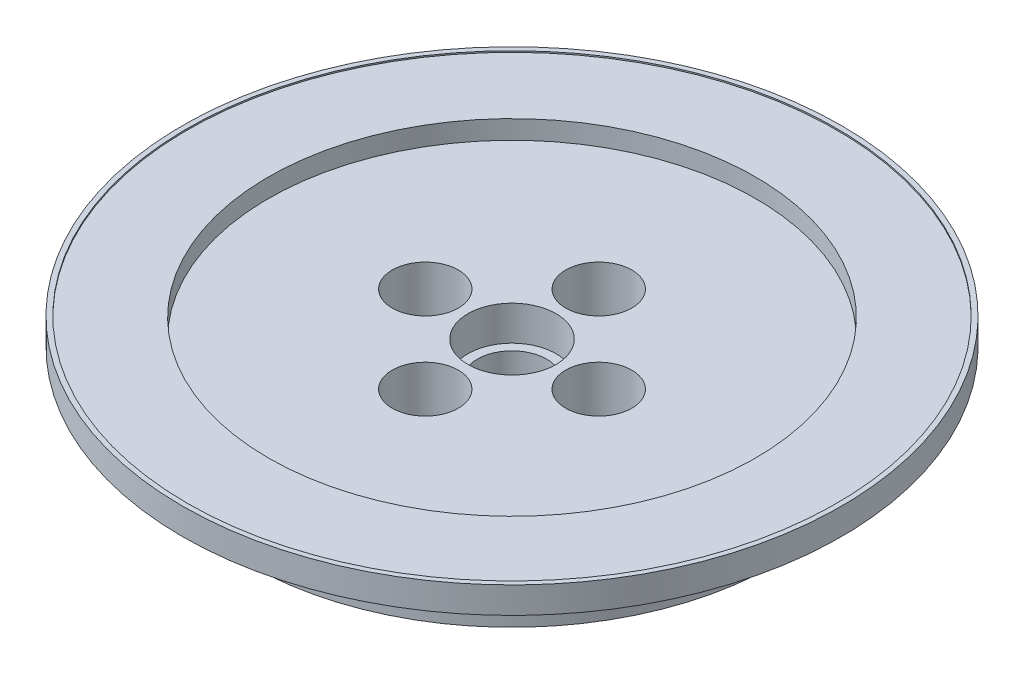
from build123d import *

# Parameters (mm, degrees)
M8_CLEARANCE_HOLE1_D     = 9.525
M8_CLEARANCE_HOLE1_DEPTH = 11.938


with BuildPart() as part:
    # Sketch1 → Revolve1 (revolve)
    with BuildSketch(Plane(origin=(0, 0, 0), x_dir=(-1, 0, 0), z_dir=(0, 0, -1)), mode=Mode.PRIVATE) as revolve1_sk:
        Polygon((-38.1, -11.938), (0, -11.938), (0, 0), (-47.498, 0), (-47.498, -3.81), (-38.1, -7.230592262), align=None)
    revolve(revolve1_sk.sketch.rotate(Axis((0, -11.938, 0), (0, 1, 0)), 270), axis=Axis((0, -11.938, 0), (0, 1, 0)))

    # Sketch2 → Cut-Revolve1 (revolve, cut)
    with BuildSketch(Plane(origin=(0, 0, 0), x_dir=(-1, 0, 0), z_dir=(0, 0, -1)), mode=Mode.PRIVATE) as cut_revolve1_sk:
        Polygon((-5, -11.938), (0, -11.938), (0, 0), (-46.798, 0), (-46.798, -0.2), (-35.1, -0.2), (-35.1, -2.9), (-6.35, -2.9), (-6.35, -7.898), (-5, -7.898), align=None)
    revolve(cut_revolve1_sk.sketch.rotate(Axis((0, -11.938, 0), (0, 1, 0)), 270), axis=Axis((0, -11.938, 0), (0, 1, 0)), mode=Mode.SUBTRACT)

    # M8 Clearance Hole1
    with Locations(Plane(origin=(0, -11.938, 0), x_dir=(-1, 0, 0), z_dir=(0, -1, 0))):
        with Locations((0, -12.5), (-12.5, 0), (0, 12.5), (12.5, 0)):
            Hole(M8_CLEARANCE_HOLE1_D / 2, depth=M8_CLEARANCE_HOLE1_DEPTH)


solid = part.part
